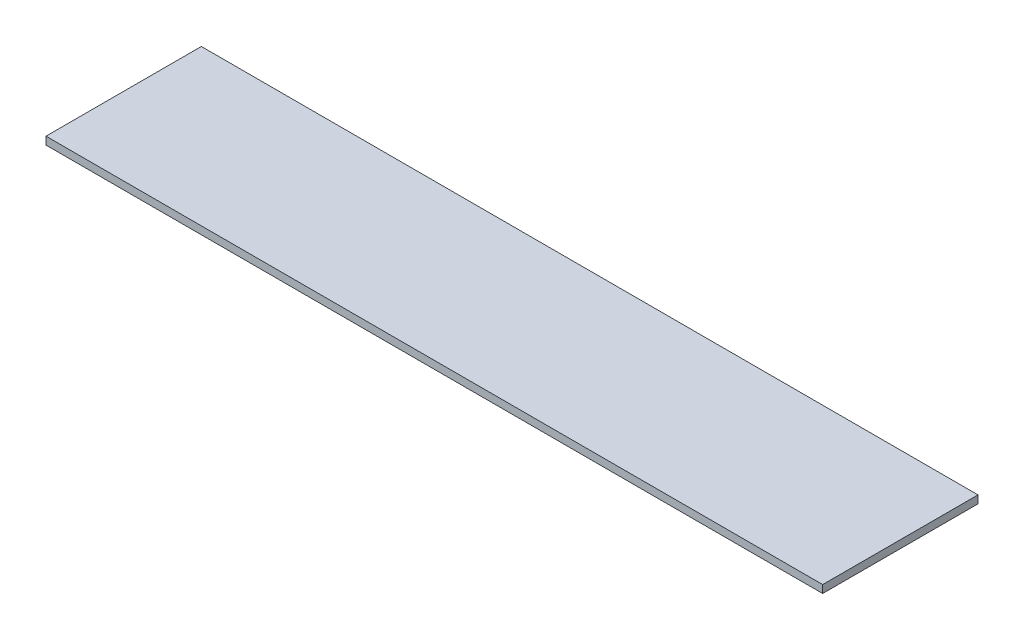
from build123d import *

# Parameters (mm, degrees)
CROQUIS1_W              = 1800
CROQUIS1_H              = 360
SALIENTE_EXTRUIR1_DEPTH = 18


with BuildPart() as part:
    # Croquis1 → Saliente-Extruir1 (new body)
    with BuildSketch(Plane(origin=(0, 0, 0), x_dir=(1, 0, 0), z_dir=(0, 1, 0))):
        Rectangle(CROQUIS1_W, CROQUIS1_H)
    extrude(amount=SALIENTE_EXTRUIR1_DEPTH)


solid = part.part
